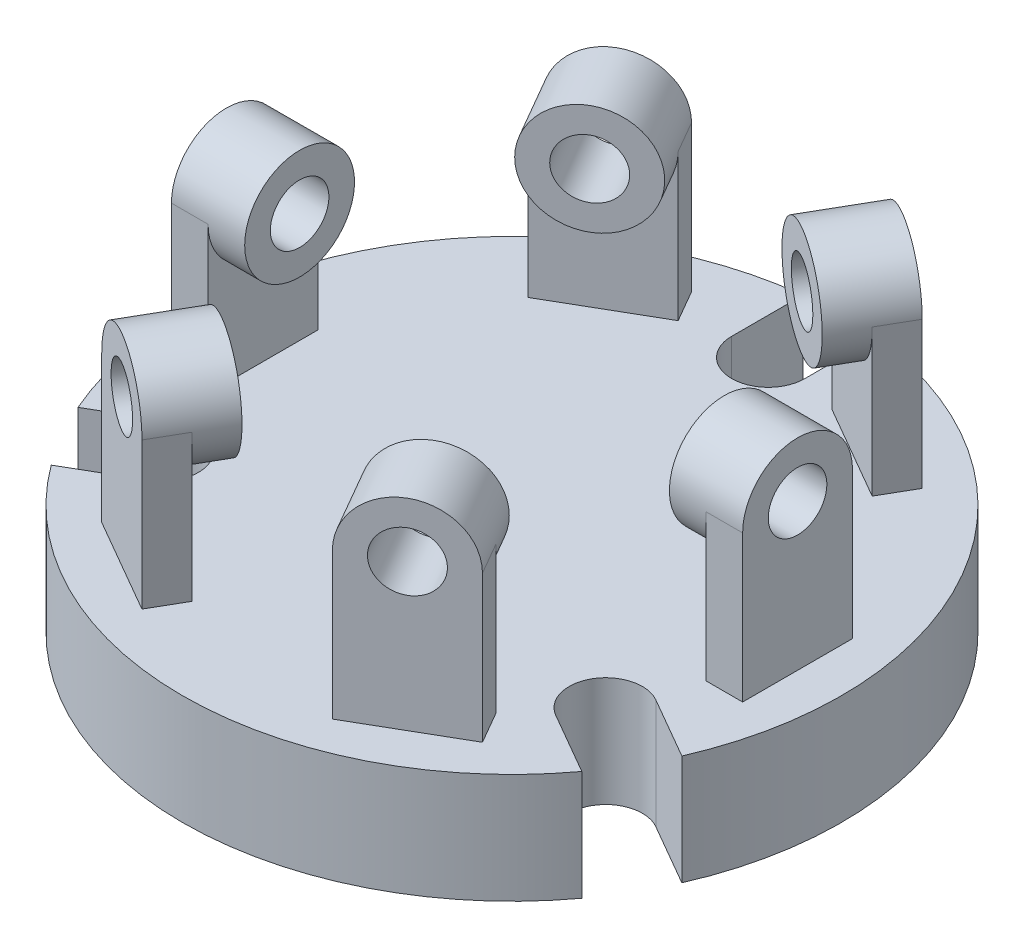
from build123d import *

# Parameters (mm, degrees)
SKETCH1_R           = 45
BOSS_EXTRUDE1_DEPTH = 15
CUT_EXTRUDE1_DEPTH  = 66.383484153
CIRPATTERN1_COUNT   = 3
SKETCH4_R           = 4
BOSS_EXTRUDE2_DEPTH = 5
SKETCH6_R           = 7.5
SKETCH6_R_2         = 4
BOSS_EXTRUDE3_DEPTH = 10
CIRPATTERN2_COUNT   = 6


with BuildPart() as part:
    # Sketch1 → Boss-Extrude1 (new body)
    with BuildSketch(Plane(origin=(0, 0, 0), x_dir=(1, 0, 0), z_dir=(0, 1, 0))):
        with Locations(Location((0, 0, 0), (0, 0, 270))):
            Circle(SKETCH1_R)
    extrude(amount=BOSS_EXTRUDE1_DEPTH)

    # Sketch2 → Cut-Extrude1 (cut, through all)
    with BuildSketch(Plane(origin=(0, 15, 0), x_dir=(1, 0, 0), z_dir=(0, 1, 0))):
        with BuildLine():
            Line((-5, 35), (-5, 44.72135955))
            ThreePointArc((-5, 44.72135955), (0, 45), (5, 44.72135955))
            Line((5, 44.72135955), (5, 35))
            ThreePointArc((5, 35), (0, 30), (-5, 35))
        make_face()
    cut_extrude1 = extrude(amount=-CUT_EXTRUDE1_DEPTH, mode=Mode.SUBTRACT)

    # CirPattern1: Cut-Extrude1 ×3 about axis
    cirpattern1_axis = Axis((0, 0, 0), (0, 1, 0))
    for i in range(1, CIRPATTERN1_COUNT):
        add(cut_extrude1.rotate(cirpattern1_axis, i * 360 / CIRPATTERN1_COUNT), mode=Mode.SUBTRACT)

    # Sketch4 → Boss-Extrude2 (add)
    with BuildSketch(Plane(origin=(39, 0, 0), x_dir=(0, 0, -1), z_dir=(1, 0, 0))):
        with BuildLine():
            Line((-7.5, 35), (-7.5, 15))
            Line((-7.5, 15), (7.5, 15))
            Line((7.5, 15), (7.5, 35))
            ThreePointArc((7.5, 35), (0, 42.5), (-7.5, 35))
        make_face()
        with Locations((0, 35)):
            Circle(SKETCH4_R, mode=Mode.SUBTRACT)
    boss_extrude2 = extrude(amount=-BOSS_EXTRUDE2_DEPTH)

    # Sketch6 → Boss-Extrude3 (add)
    with BuildSketch(Plane(origin=(39, 0, 0), x_dir=(0, 0, -1), z_dir=(1, 0, 0))):
        with Locations((0, 35)):
            Circle(SKETCH6_R)
        with Locations((0, 35)):
            Circle(SKETCH6_R_2, mode=Mode.SUBTRACT)
    boss_extrude3 = extrude(amount=-BOSS_EXTRUDE3_DEPTH)

    # CirPattern2: Boss-Extrude2, Boss-Extrude3 ×6 about axis
    cirpattern2_axis = Axis((0, 0, 0), (0, 1, 0))
    add([boss_extrude2.rotate(cirpattern2_axis, i * 360 / CIRPATTERN2_COUNT) for i in range(1, CIRPATTERN2_COUNT)])
    add([boss_extrude3.rotate(cirpattern2_axis, i * 360 / CIRPATTERN2_COUNT) for i in range(1, CIRPATTERN2_COUNT)])


solid = part.part
